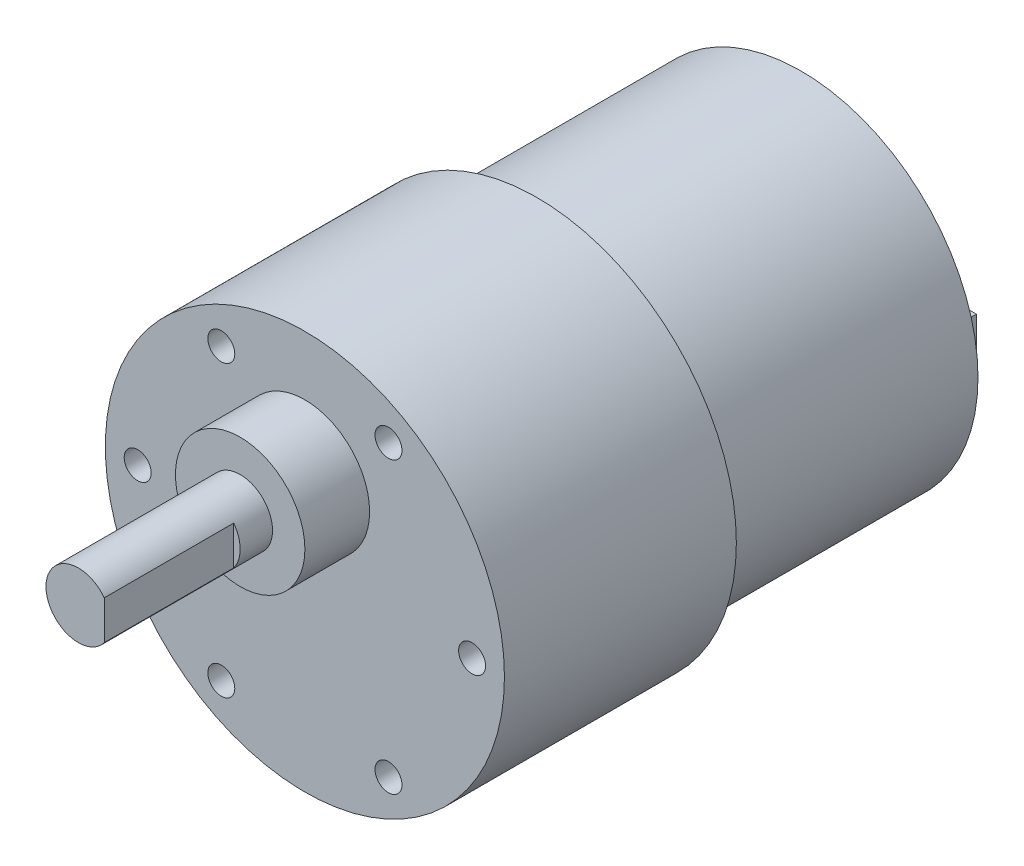
from build123d import *

# Parameters (mm, degrees)
EXTRUDE_START          = -21.5
SKETCH_1_R             = 18.5
EXTRUDE_37_21_5_DEPTH  = 21.5
EXTRUDE_START_2        = -44.5
SKETCH_2_R             = 16.4
EXTRUDE_32_8_23_DEPTH  = 23
PCB_START              = -46
SKETCH_3_R             = 16.4
PCB_DEPTH              = 1.5
EXTRUDE_START_3        = -50
SKETCH_4_R             = 6.75
EXTRUDE_504_DEPTH      = 4
XH2_54_START           = -55.5
SKETCH_5_W             = 13.5
SKETCH_5_H             = 7
XH2_54_DEPTH           = 9.5
SKETCH_6_R             = 6
F_7MM_12_DEPTH         = 6
EXTRUDE_START_4        = 6
SKETCH_7_R             = 3
EXTRUDE_6_DEPTH        = 3
EXTRUDE_START_5        = 9
EXTRUDE_D_5_4_12_DEPTH = 12
SKETCH_9_R             = 1.25
F_6XM3_3_DEPTH         = 3


with BuildPart() as part:
    # 草图1 → 减速箱_直径37_长21.5 (new body)
    with BuildSketch(Plane.XY.offset(EXTRUDE_START)):
        Circle(SKETCH_1_R)
    extrude(amount=EXTRUDE_37_21_5_DEPTH)

    # 草图2 → 电机壳_直径32.8_长23 (add)
    with BuildSketch(Plane.XY.offset(EXTRUDE_START_2)):
        Circle(SKETCH_2_R)
    extrude(amount=EXTRUDE_32_8_23_DEPTH)

    # 草图3 → 编码器PCB (add)
    with BuildSketch(Plane.XY.offset(PCB_START)):
        Circle(SKETCH_3_R)
    extrude(amount=PCB_DEPTH)

    # 草图4 → Extrude 504 (add)
    with BuildSketch(Plane.XY.offset(EXTRUDE_START_3)):
        Circle(SKETCH_4_R)
    extrude(amount=EXTRUDE_504_DEPTH)

    # 草图5 → XH2.54连接器_外形简化 (add)
    with BuildSketch(Plane.XY.offset(XH2_54_START)):
        with Locations((0, -8)):
            Rectangle(SKETCH_5_W, SKETCH_5_H)
    extrude(amount=XH2_54_DEPTH)

    # 草图6 → 偏心7mm_轴台直径12 (add)
    with BuildSketch(Plane.XY):
        with Locations((0, 7)):
            Circle(SKETCH_6_R)
    extrude(amount=F_7MM_12_DEPTH)

    # 草图7 → 输出轴直径6 (add)
    with BuildSketch(Plane.XY.offset(EXTRUDE_START_4)):
        with Locations((0, 7)):
            Circle(SKETCH_7_R)
    extrude(amount=EXTRUDE_6_DEPTH)

    # 草图8 → D轴_5.4对边_削平长12 (add)
    with BuildSketch(Plane.XY.offset(EXTRUDE_START_5)):
        with BuildLine():
            Line((2.4, 5.2), (2.4, 8.8))
            ThreePointArc((2.4, 8.8), (-3, 7), (2.4, 5.2))
        make_face()
    extrude(amount=EXTRUDE_D_5_4_12_DEPTH)

    # 草图9 → 6xM3安装底孔_深3_牙型简化 (cut)
    with BuildSketch(Plane.XY):
        with Locations((15.5, 0)):
            Circle(SKETCH_9_R)
        with Locations((7.75, 13.423393759)):
            Circle(SKETCH_9_R)
        with Locations((-7.75, 13.423393759)):
            Circle(SKETCH_9_R)
        with Locations((-15.5, 0)):
            Circle(SKETCH_9_R)
        with Locations((-7.75, -13.423393759)):
            Circle(SKETCH_9_R)
        with Locations((7.75, -13.423393759)):
            Circle(SKETCH_9_R)
    extrude(amount=-F_6XM3_3_DEPTH, mode=Mode.SUBTRACT)


solid = part.part
